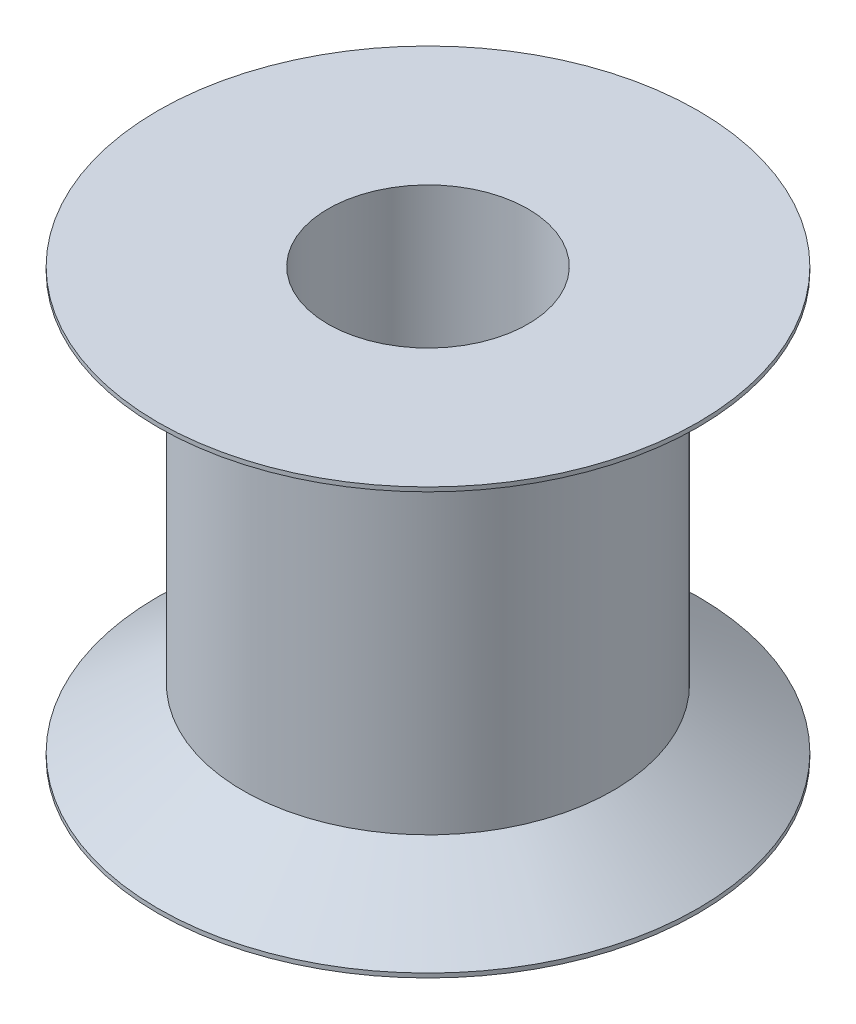
from build123d import *


with BuildPart() as part:
    # Sketch1 → Revolve1 (revolve)
    with BuildSketch(Plane(origin=(0, 0, 0), x_dir=(0, 0, -1), z_dir=(1, 0, 0))):
        Polygon((2.35, 5), (2.35, -5), (6.35, -5), (6.35, -4.9), (4.35, -3.5), (4.35, 3.5), (6.35, 4.9), (6.35, 5), align=None)
    revolve(axis=Axis((0, 0, 0), (0, 1, 0)))


solid = part.part
